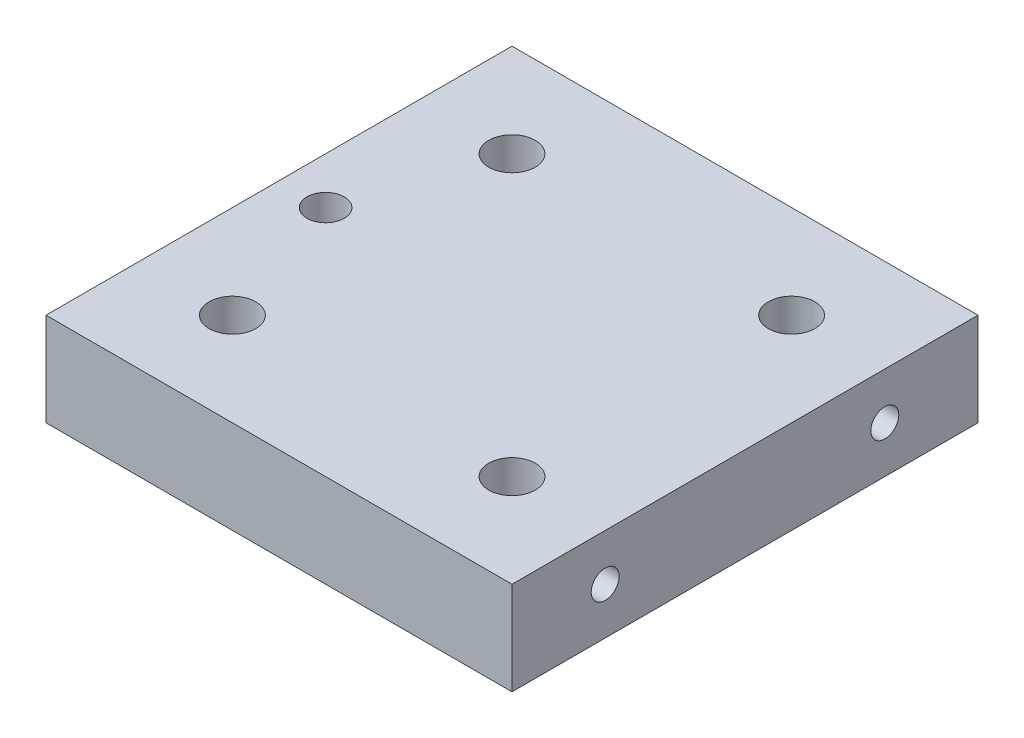
from build123d import *

# Parameters (mm, degrees)
SKETCH_1_W          = 100
SKETCH_1_H          = 100
EXTRUDE_1_DEPTH     = 20
SKETCH_2_R          = 5
SKETCH_2_R_2        = 4
CUT_EXTRUDE_1_DEPTH = 20
SKETCH_3_R          = 3
CUT_EXTRUDE_2_DEPTH = 20
CUT_EXTRUDE_START   = -20
SKETCH_4_R          = 3
CUT_EXTRUDE_3_DEPTH = 20


with BuildPart() as part:
    # Эскиз1 → Бобышка-Вытянуть1 (new body)
    with BuildSketch(Plane(origin=(0, 0, 0), x_dir=(1, 0, 0), z_dir=(0, 1, 0))):
        with Locations((50, 50)):
            Rectangle(SKETCH_1_W, SKETCH_1_H)
    extrude(amount=EXTRUDE_1_DEPTH)

    # Эскиз2 → Вырез-Вытянуть1 (cut)
    with BuildSketch(Plane.XZ):
        with Locations(Location((20, -20, 0), (0, 0, 270))):
            Circle(SKETCH_2_R)
        with Locations(Location((10, -50, 0), (0, 0, 270))):
            Circle(SKETCH_2_R_2)
        with Locations(Location((20, -80, 0), (0, 0, 270))):
            Circle(SKETCH_2_R)
        with Locations(Location((80, -20, 0), (0, 0, 270))):
            Circle(SKETCH_2_R)
        with Locations(Location((80, -80, 0), (0, 0, 270))):
            Circle(SKETCH_2_R)
    extrude(amount=-CUT_EXTRUDE_1_DEPTH, mode=Mode.SUBTRACT)

    # Эскиз3 → Вырез-Вытянуть2 (cut)
    with BuildSketch(Plane.ZY):
        with Locations((-80, 10)):
            Circle(SKETCH_3_R)
        with Locations((-20, 10)):
            Circle(SKETCH_3_R)
    extrude(amount=-CUT_EXTRUDE_2_DEPTH, mode=Mode.SUBTRACT)

    # Эскиз4 → Вырез-Вытянуть3 (cut)
    with BuildSketch(Plane(origin=(100, 0, 0), x_dir=(0, 0, -1), z_dir=(1, 0, 0)).offset(CUT_EXTRUDE_START)):
        with Locations(Location((20, 10, 0), (0, 0, 180))):
            Circle(SKETCH_4_R)
        with Locations(Location((80, 10, 0), (0, 0, 180))):
            Circle(SKETCH_4_R)
    extrude(amount=CUT_EXTRUDE_3_DEPTH, mode=Mode.SUBTRACT)


solid = part.part
